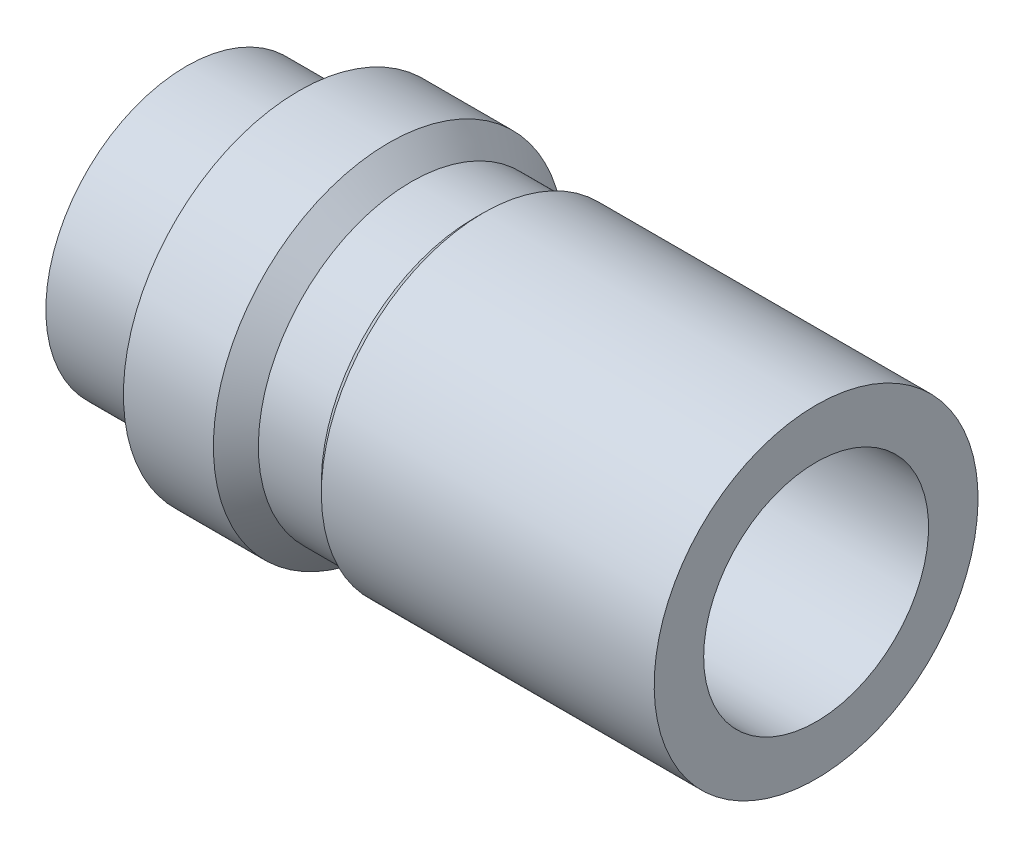
from build123d import *

# Parameters (mm, degrees)
F_1_2_0_5_DIAMETER_HOLE1_D = 12.7
CHAMFER1_SIZE              = 0.762


with BuildPart() as part:
    # Sketch1 → Revolve1 (revolve)
    with BuildSketch(Plane.XY):
        Polygon((6.35, 7.9375), (6.35, 9.906), (11.43, 9.906), (12.7, 8.636), (16.256, 8.636), (16.764, 9.144), (35.56, 9.144), (35.56, 5.08), (35.56, 0), (0, 0), (0, 7.9375), align=None)
    revolve(axis=Axis((35.56, 0, 0), (-1, 0, 0)))

    # 1/2 (0.5) Diameter Hole1 (through all)
    with Locations(Plane.ZY):
        with Locations((0, 0)):
            Hole(F_1_2_0_5_DIAMETER_HOLE1_D / 2)

    # Chamfer1
    chamfer1_edges = [part.edges().sort_by_distance(p)[0] for p in [
        (0, 0, 6.35),
    ]]
    chamfer(chamfer1_edges, length=CHAMFER1_SIZE)


solid = part.part
